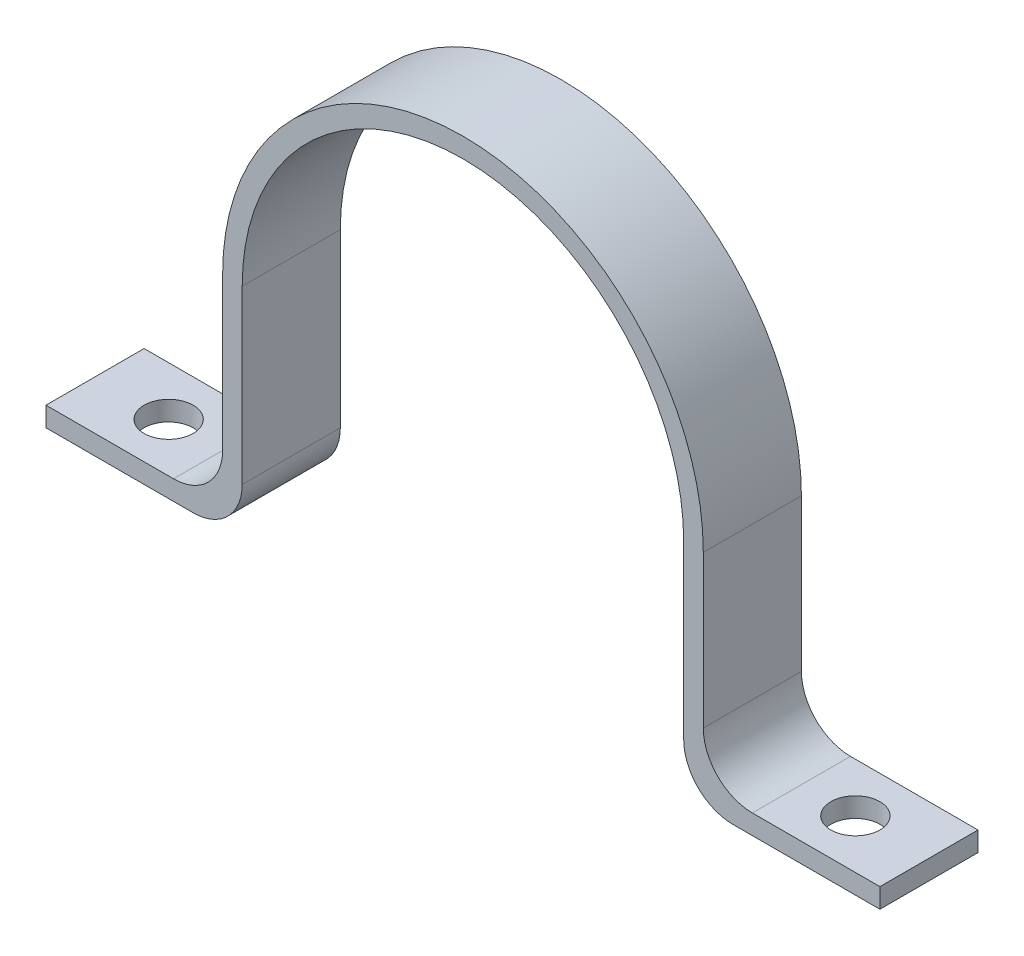
from build123d import *

# Parameters (mm, degrees)
BOSS_EXTRUDE1_DEPTH = 10
FILLET11_R          = 5
FILLET12_R          = 5
FILLET13_R          = 5
SKETCH7_W           = 10
SKETCH7_H           = 2
BOSS_EXTRUDE5_DEPTH = 10
SKETCH8_W           = 10
SKETCH8_H           = 2
BOSS_EXTRUDE6_DEPTH = 10
SKETCH9_R           = 2.5
CUT_EXTRUDE2_DEPTH  = 10


with BuildPart() as part:
    # Sketch2 → Boss-Extrude1 (new body)
    with BuildSketch(Plane.XY):
        with BuildLine():
            Line((24.5, -20.5), (32.5, -20.5))
            Line((32.5, -20.5), (32.5, -22.5))
            Line((32.5, -22.5), (22.5, -22.5))
            Line((22.5, -22.5), (22.5, 0))
            ThreePointArc((22.5, 0), (0, 22.5), (-22.5, 0))
            Line((-22.5, 0), (-22.5, -22.5))
            Line((-22.5, -22.5), (-32.5, -22.5))
            Line((-32.5, -22.5), (-32.5, -20.5))
            Line((-32.5, -20.5), (-24.5, -20.5))
            Line((-24.5, -20.5), (-24.5, 0))
            ThreePointArc((-24.5, 0), (0, 24.5), (24.5, 0))
            Line((24.5, 0), (24.5, -20.5))
        make_face()
    extrude(amount=BOSS_EXTRUDE1_DEPTH)

    # Fillet11
    fillet11_edges = [part.edges().sort_by_distance(p)[0] for p in [
        (-22.5, -22.5, 5),
    ]]
    fillet(fillet11_edges, radius=FILLET11_R)

    # Fillet12
    fillet12_edges = [part.edges().sort_by_distance(p)[0] for p in [
        (-24.5, -20.5, 5),
    ]]
    fillet(fillet12_edges, radius=FILLET12_R)

    # Fillet13
    fillet13_edges = [part.edges().sort_by_distance(p)[0] for p in [
        (24.5, -20.5, 5),
        (22.5, -22.5, 5),
    ]]
    fillet(fillet13_edges, radius=FILLET13_R)

    # Sketch7 → Boss-Extrude5 (add)
    with BuildSketch(Plane(origin=(32.5, 0, 0), x_dir=(0, 0, -1), z_dir=(1, 0, 0))):
        with Locations((-5, -21.5)):
            Rectangle(SKETCH7_W, SKETCH7_H)
    extrude(amount=BOSS_EXTRUDE5_DEPTH)

    # Sketch8 → Boss-Extrude6 (add)
    with BuildSketch(Plane.ZY.offset(32.5)):
        with Locations((5, -21.5)):
            Rectangle(SKETCH8_W, SKETCH8_H)
    extrude(amount=BOSS_EXTRUDE6_DEPTH)

    # Sketch9 → Cut-Extrude2 (cut)
    with BuildSketch(Plane(origin=(0, -20.5, 0), x_dir=(1, 0, 0), z_dir=(0, 1, 0))):
        with Locations(Location((-35, -5, 0), (0, 0, 180))):
            Circle(SKETCH9_R)
    cut_extrude2 = extrude(amount=-CUT_EXTRUDE2_DEPTH, mode=Mode.SUBTRACT)

    # Mirror2: Cut-Extrude2 across plane
    add(cut_extrude2.mirror(Plane(origin=(0, 0, 0), x_dir=(0, 0, 1), z_dir=(1, 0, 0))), mode=Mode.SUBTRACT)


solid = part.part
